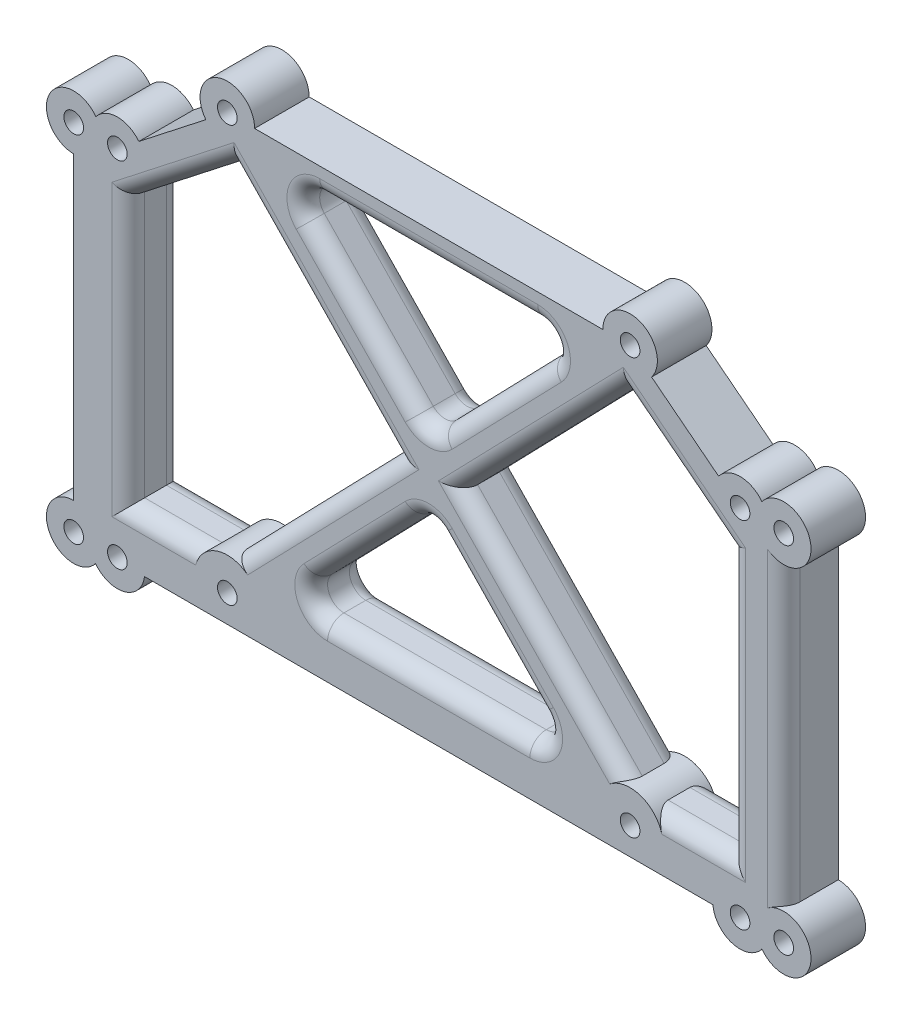
from build123d import *

# Parameters (mm, degrees)
SKETCH2_R           = 1.7999999999999927
SKETCH2_R_2         = 1.8000000000000014
SKETCH2_R_3         = 1.7999999999999936
SKETCH2_R_4         = 1.8000000000000005
BOSS_EXTRUDE1_DEPTH = 10
CUT_EXTRUDE1_DEPTH  = 86.30841107417254
FILLET1_R           = 3


with BuildPart() as part:
    # Sketch2 → Boss-Extrude1 (new body)
    with BuildSketch(Plane.XY):
        with BuildLine():
            ThreePointArc((-60.998373193608856, 25.417629235091972), (-69.50179079881426, 24.76016426994454), (-65.04884175350759, 17.486127155053257))
            Line((-65.04884175350759, 17.486127155053268), (-65.05000000000001, -37.513872834627236))
            ThreePointArc((-65.05000000000001, -37.513872834627236), (-69.52213595499958, -44.74994081212703), (-61.050000000000004, -45.51387283462723))
            ThreePointArc((-61.05, -45.51387283462723), (-55.75009387067255, -47.34194119111691), (-52.0844733465611, -43.09999999999998))
            Line((-52.084473346561104, -43.09999999999998), (-36.9, -43.09999999999998))
            Line((-36.9, -43.09999999999998), (36.9, -43.09999999999998))
            Line((36.9, -43.09999999999998), (52.07029117317087, -43.09999999999998))
            ThreePointArc((52.07029117317087, -43.09999999999998), (55.68413677612224, -47.459825116743666), (61.04999999999999, -45.65000000000001))
            ThreePointArc((61.04999999999999, -45.65000000000001), (69.52213595499958, -44.8860679774998), (65.04999999999998, -37.650000000000006))
            Line((65.04999999999998, -37.650000000000006), (65.05, 17.349999999999987))
            ThreePointArc((65.05, 17.349999999999984), (69.52213595499958, 24.586067977499784), (61.04999999999999, 25.349999999999994))
            ThreePointArc((61.04999999999999, 25.349999999999994), (57.09985568418244, 27.349751434896987), (53.110619235405444, 25.42916858771037))
            Line((53.110619235405444, 25.42916858771037), (40.839380764594566, 35.020831412289596))
            ThreePointArc((40.839380764594566, 35.020831412289596), (38.528357481793726, 42.827414929058605), (31.900000000000006, 38.09999999999998))
            Line((31.900000000000006, 38.09999999999998), (-31.89999999999999, 38.09999999999998))
            ThreePointArc((-31.899999999999988, 38.09999999999998), (-38.52835748179412, 42.82741492905847), (-40.839380764594004, 35.02083141228891))
            Line((-40.83938076459401, 35.02083141228891), (-53.11061923540529, 25.4291685877102))
            ThreePointArc((-53.11061923540529, 25.4291685877102), (-57.05731471869626, 27.349994649486177), (-60.99837319360884, 25.41762923509198))
        make_face()
        with Locations((-65.05000000000001, -42.513872834627236)):
            Circle(SKETCH2_R, mode=Mode.SUBTRACT)
        with Locations((-57.050000000000004, -42.513872834627236)):
            Circle(SKETCH2_R_2, mode=Mode.SUBTRACT)
        with Locations((-36.9, -38.09999999999998)):
            Circle(SKETCH2_R_2, mode=Mode.SUBTRACT)
        with Locations((36.9, -38.09999999999998)):
            Circle(SKETCH2_R_2, mode=Mode.SUBTRACT)
        with Locations((57.050000000000004, -42.650000000000006)):
            Circle(SKETCH2_R_2, mode=Mode.SUBTRACT)
        with Locations((65.05, -42.650000000000006)):
            Circle(SKETCH2_R, mode=Mode.SUBTRACT)
        with Locations((-65.04884175350765, 22.486127155053268)):
            Circle(SKETCH2_R_3, mode=Mode.SUBTRACT)
        with Locations((-57.050000000000004, 22.349999999999977)):
            Circle(SKETCH2_R_3, mode=Mode.SUBTRACT)
        with Locations((-36.89999999999999, 38.09999999999998)):
            Circle(SKETCH2_R_2, mode=Mode.SUBTRACT)
        with Locations((57.050000000000004, 22.349999999999987)):
            Circle(SKETCH2_R_4, mode=Mode.SUBTRACT)
        with Locations((65.05, 22.34999999999999)):
            Circle(SKETCH2_R_3, mode=Mode.SUBTRACT)
        with Locations((36.900000000000006, 38.09999999999998)):
            Circle(SKETCH2_R_2, mode=Mode.SUBTRACT)
    extrude(amount=BOSS_EXTRUDE1_DEPTH)

    # Sketch3 → Cut-Extrude1 (cut, through all)
    with BuildSketch(Plane.XY.offset(10)):
        with BuildLine():
            Line((-35.941987653909244, 29.964173484996504), (-55.04889348556858, 15.02949522948242))
            Line((-55.04889348556858, 15.02949522948242), (-55.04991738847525, -33.591122423586484))
            Line((-55.04991738847525, -33.591122423586484), (-40.85853798780756, -33.591122423586484))
            ThreePointArc((-40.85853798780756, -33.591122423586484), (-38.65263543886247, -32.3616841304749), (-36.13624745721949, -32.148808350137216))
            Line((-36.13624745721949, -32.148808350137216), (-5.96078383225156, -0.9920288349264463))
            Line((-5.960783832251558, -0.9920288349264474), (-35.941987653909244, 29.964173484996504))
        make_face()
        with BuildLine():
            ThreePointArc((36.13624745721953, -32.148808350137216), (38.65263543886248, -32.36168413047491), (40.85853798780755, -33.591122423586484))
            Line((40.85853798780755, -33.591122423586484), (55.05, -33.591122423586484))
            Line((55.05, -33.591122423586484), (55.05, 15.028630336068145))
            Line((55.05, 15.028630336068145), (35.94198765390981, 29.964173484997207))
            Line((35.94198765390981, 29.964173484997207), (5.960783832251529, -0.9920288349263657))
            Line((5.960783832251532, -0.9920288349263677), (36.13624745721953, -32.148808350137216))
        make_face()
        Polygon((2.842e-14, 5.162601626016247), (27.05748031496067, 33.09999999999998), (-27.05748031496062, 33.09999999999998), align=None)
        Polygon((-5.551e-14, -7.146659295869048), (-25.611566651253955, -33.591122423586484), (25.61156665125385, -33.591122423586484), align=None)
    extrude(amount=-CUT_EXTRUDE1_DEPTH, mode=Mode.SUBTRACT)

    # Fillet1
    fillet1_edges = [part.edges().sort_by_distance(p)[0] for p in [
        (21.04851564473553, -16.57041859253179, 0),
        (20.95138574308067, 14.486072325035423, 0),
        (45.4959938269549, 22.496401910532676, 10),
        (55.05, -9.281246043759168, 10),
        (47.954268993903774, -33.591122423586484, 0),
        (45.49599382695491, 22.49640191053268, -8.9e-16),
        (47.954268993903774, -33.591122423586484, 10),
        (20.95138574308067, 14.48607232503542, 10),
        (21.04851564473553, -16.570418592531794, 10),
        (2.842e-14, 33.09999999999998, 10),
        (-27.05748031496062, 33.09999999999998, 5),
        (13.52874015748035, 19.131300813008114, 10),
        (27.057480314960674, 33.09999999999998, 5),
        (-13.528740157480296, 19.131300813008114, -8.9e-16),
        (2.842e-14, 5.162601626016247, 5),
        (2.842e-14, 33.09999999999998, 0),
        (13.52874015748035, 19.131300813008114, 0),
        (-13.528740157480296, 19.131300813008114, 10),
        (12.805783325626894, -20.368890859727767, 10),
        (-5.551e-14, -7.146659295869048, 5),
        (-5.329e-14, -33.591122423586484, 0),
        (25.611566651253845, -33.591122423586484, 5),
        (-12.805783325627004, -20.368890859727763, -8.9e-16),
        (-25.611566651253955, -33.591122423586484, 5),
        (12.805783325626894, -20.368890859727767, 0),
        (-12.805783325627004, -20.368890859727763, 10),
        (-5.329e-14, -33.591122423586484, 10),
        (-47.9542276881414, -33.591122423586484, 0),
        (-55.04940543702191, -9.280813597052033, 0),
        (-45.49544056973891, 22.49683435723946, 10),
        (-20.9513857430804, 14.486072325035028, 10),
        (-21.048515644735524, -16.57041859253183, 10),
        (-45.49544056973892, 22.496834357239464, 0),
        (-20.9513857430804, 14.48607232503503, 0),
        (-21.04851564473552, -16.57041859253183, 0),
        (-55.04940543702192, -9.280813597052033, 10),
        (-47.9542276881414, -33.591122423586484, 10),
        (65.04999999999998, -10.15000000000001, 10),
    ]]
    fillet(fillet1_edges, radius=FILLET1_R)


solid = part.part
